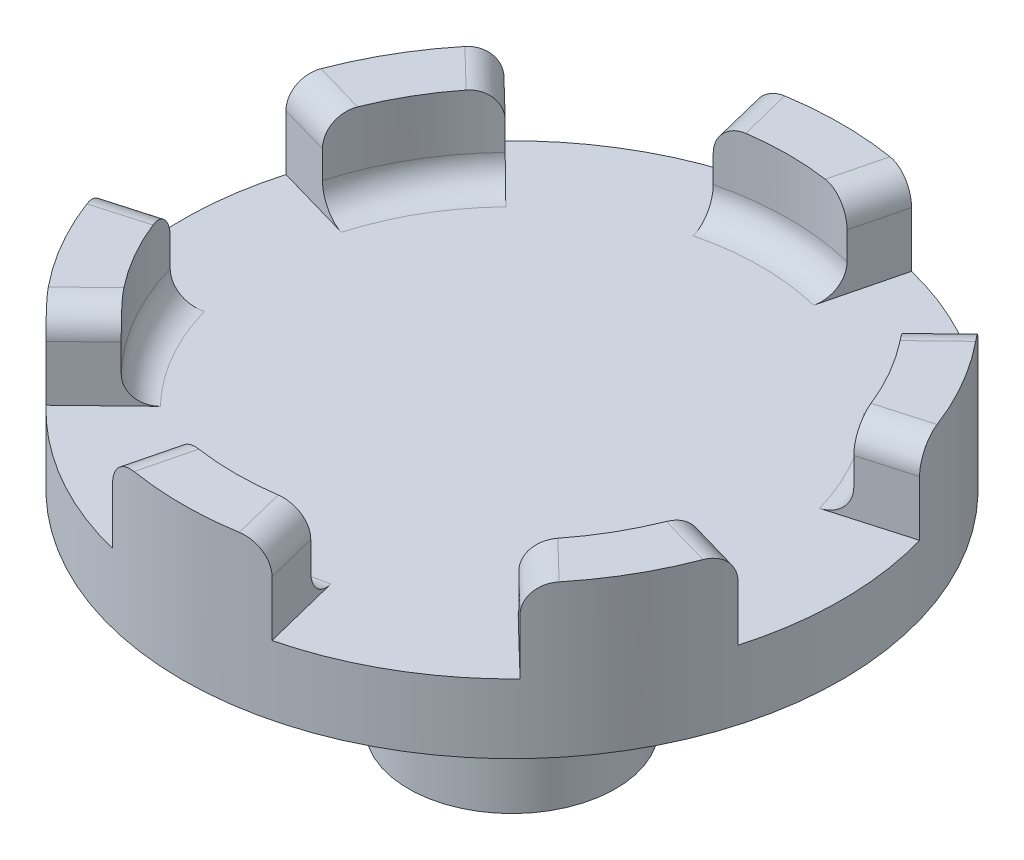
from build123d import *
from build123d.topology import SkipClean

# Parameters (mm, degrees)
SKETCH1_R           = 30.2895
BOSS_EXTRUDE1_DEPTH = 6.35
BOSS_EXTRUDE2_DEPTH = 7.62
FILLET1_R           = 2.54
SKETCH3_R           = 12.7
BOSS_EXTRUDE3_DEPTH = 6.35
FILLET2_R           = 2.54
SKETCH4_R           = 9.525
BOSS_EXTRUDE4_DEPTH = 12.7


with BuildPart() as part:
    # Sketch1 → Boss-Extrude1 (new body)
    with BuildSketch(Plane(origin=(0, 0, 0), x_dir=(1, 0, 0), z_dir=(0, 1, 0))):
        with Locations(Location((0, 0, 0), (0, 0, 270))):
            Circle(SKETCH1_R)
    extrude(amount=BOSS_EXTRUDE1_DEPTH)

    # Sketch2 → Boss-Extrude2 (add)
    with SkipClean():  # the faces are left unmerged after this step: merging them gives an invalid solid
        with BuildSketch(Plane(origin=(0, 6.35, 0), x_dir=(1, 0, 0), z_dir=(0, 1, 0))):
            with BuildLine():
                ThreePointArc((6.148158832, -24.644677782), (0, -25.4), (-6.148158832, -24.644677782))
                Line((-6.148158832, -24.644677782), (-7.331679408, -29.388778255))
                ThreePointArc((-7.331679408, -29.388778255), (0, -30.2895), (7.331679408, -29.388778255))
                Line((7.331679408, -29.388778255), (6.148158832, -24.644677782))
            make_face()
            with BuildLine():
                Line((18.268837611, -17.646800626), (21.785588851, -21.043809747))
                ThreePointArc((21.785588851, -21.043809747), (26.231476468, -15.14475), (29.117268259, -8.344968508))
                Line((29.117268259, -8.344968508), (24.416996443, -6.997877156))
                ThreePointArc((24.416996443, -6.997877156), (21.997045256, -12.7), (18.268837611, -17.646800626))
            make_face()
            with BuildLine():
                Line((24.416996443, 6.997877156), (29.117268259, 8.344968508))
                ThreePointArc((29.117268259, 8.344968508), (26.231476468, 15.14475), (21.785588851, 21.043809747))
                Line((21.785588851, 21.043809747), (18.268837611, 17.646800626))
                ThreePointArc((18.268837611, 17.646800626), (21.997045256, 12.7), (24.416996443, 6.997877156))
            make_face()
            with BuildLine():
                ThreePointArc((-21.785588851, 21.043809747), (-26.231476468, 15.14475), (-29.117268259, 8.344968508))
                Line((-29.117268259, 8.344968508), (-24.416996443, 6.997877156))
                ThreePointArc((-24.416996443, 6.997877156), (-21.997045256, 12.7), (-18.268837611, 17.646800626))
                Line((-18.268837611, 17.646800626), (-21.785588851, 21.043809747))
            make_face()
            with BuildLine():
                ThreePointArc((-29.117268259, -8.344968508), (-26.231476468, -15.14475), (-21.785588851, -21.043809747))
                Line((-21.785588851, -21.043809747), (-18.268837611, -17.646800626))
                ThreePointArc((-18.268837611, -17.646800626), (-21.997045256, -12.7), (-24.416996443, -6.997877156))
                Line((-24.416996443, -6.997877156), (-29.117268259, -8.344968508))
            make_face()
            with BuildLine():
                ThreePointArc((-7.331679408, 29.388778255), (0, 30.2895), (7.331679408, 29.388778255))
                Line((7.331679408, 29.388778255), (6.148158832, 24.644677782))
                ThreePointArc((6.148158832, 24.644677782), (0, 25.4), (-6.148158832, 24.644677782))
                Line((-6.148158832, 24.644677782), (-7.331679408, 29.388778255))
            make_face()
        extrude(amount=BOSS_EXTRUDE2_DEPTH)

    # Fillet1
    fillet1_edges = [part.edges().sort_by_distance(p)[0] for p in [
        (26.767132351, 13.97, 7.671422832),
        (20.027213231, 13.97, 19.345305187),
        (20.027213231, 13.97, -19.345305187),
        (26.767132351, 13.97, -7.671422832),
        (-26.767132351, 13.97, -7.671422832),
        (-20.027213231, 13.97, -19.345305187),
        (-20.027213231, 13.97, 19.345305187),
        (-26.767132351, 13.97, 7.671422832),
        (-6.73991912, 13.97, -27.016728018),
        (6.73991912, 13.97, -27.016728018),
        (6.73991912, 13.97, 27.016728018),
        (-6.73991912, 13.97, 27.016728018),
    ]]
    fillet(fillet1_edges, radius=FILLET1_R)

    # Sketch3 → Boss-Extrude3 (add)
    with BuildSketch(Plane.XZ):
        with Locations(Location((0, 0, 0), (0, 0, 270))):
            Circle(SKETCH3_R)
    extrude(amount=BOSS_EXTRUDE3_DEPTH)

    # Fillet2
    fillet2_edges = [part.edges().sort_by_distance(p)[0] for p in [
        (21.997045256, 6.35, 12.7),
        (21.997045256, 6.35, -12.7),
        (-21.997045256, 6.35, -12.7),
        (-21.997045256, 6.35, 12.7),
        (0, 6.35, -25.4),
        (0, 6.35, 25.4),
    ]]
    fillet(fillet2_edges, radius=FILLET2_R)

    # Sketch4 → Boss-Extrude4 (add)
    with BuildSketch(Plane.XZ.offset(6.35)):
        with Locations(Location((0, 0, 0), (0, 0, 270))):
            Circle(SKETCH4_R)
    extrude(amount=BOSS_EXTRUDE4_DEPTH)


solid = part.part
